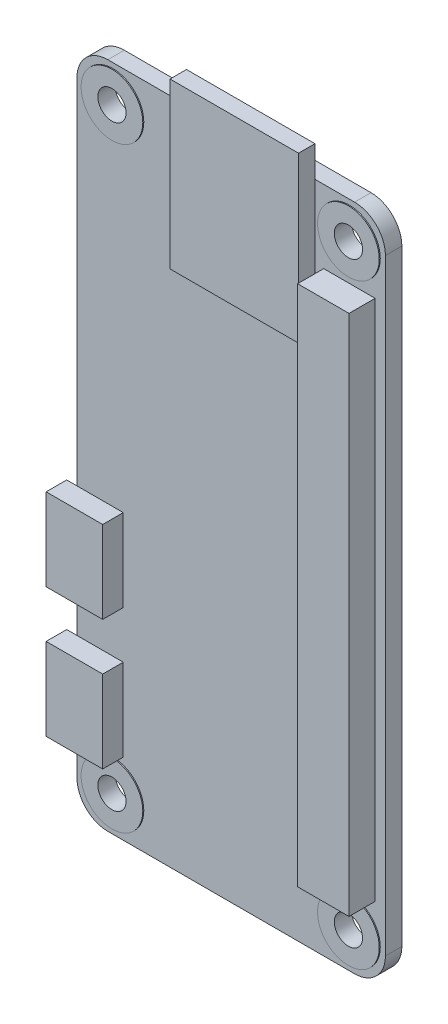
from build123d import *

# Parameters (mm, degrees)
SKETCH1_W           = 30
SKETCH1_H           = 65
SKETCH1_R           = 1.375
BOSS_EXTRUDE1_DEPTH = 0.8
SKETCH4_R           = 3
SKETCH4_R_2         = 1.375
EXTRUDE_THIN1_DEPTH = 0.1
FILLET1_R           = 3
SKETCH2_W           = 12.5
SKETCH2_H           = 16
BOSS_EXTRUDE2_DEPTH = 1.6
SKETCH3_W           = 5
SKETCH3_H           = 50.8
BOSS_EXTRUDE3_DEPTH = 2.54
SKETCH5_W           = 5.5
SKETCH5_H           = 8
BOSS_EXTRUDE4_DEPTH = 2


with BuildPart() as part:
    # Sketch1 → Boss-Extrude1 (new, symmetric)
    with BuildSketch(Plane.XY):
        Rectangle(SKETCH1_W, SKETCH1_H)
        with Locations((11.5, -29)):
            Circle(SKETCH1_R, mode=Mode.SUBTRACT)
        with Locations((-11.5, -29)):
            Circle(SKETCH1_R, mode=Mode.SUBTRACT)
        with Locations((11.5, 29)):
            Circle(SKETCH1_R, mode=Mode.SUBTRACT)
        with Locations((-11.5, 29)):
            Circle(SKETCH1_R, mode=Mode.SUBTRACT)
    extrude(amount=BOSS_EXTRUDE1_DEPTH, both=True)

    # Sketch4 → Extrude-Thin1 (add)
    # profile 1 of 4: a face of its own
    with BuildSketch(Plane.XY.offset(0.8)):
        with Locations((11.5, 29)):
            Circle(SKETCH4_R)
        with Locations((11.5, 29)):
            Circle(SKETCH4_R_2, mode=Mode.SUBTRACT)
    # profile 2 of 4: a face of its own
    with BuildSketch(Plane.XY.offset(0.8)):
        with Locations((11.5, -29)):
            Circle(SKETCH4_R)
        with Locations((11.5, -29)):
            Circle(SKETCH4_R_2, mode=Mode.SUBTRACT)
    # profile 3 of 4: a face of its own
    with BuildSketch(Plane.XY.offset(0.8)):
        with Locations((-11.5, -29)):
            Circle(SKETCH4_R)
        with Locations((-11.5, -29)):
            Circle(SKETCH4_R_2, mode=Mode.SUBTRACT)
    # profile 4 of 4: a face of its own
    with BuildSketch(Plane.XY.offset(0.8)):
        with Locations((-11.5, 29)):
            Circle(SKETCH4_R)
        with Locations((-11.5, 29)):
            Circle(SKETCH4_R_2, mode=Mode.SUBTRACT)
    extrude(amount=EXTRUDE_THIN1_DEPTH)

    # Fillet1
    fillet1_edges = [part.edges().sort_by_distance(p)[0] for p in [
        (-15, -32.5, 0),
        (-15, 32.5, 0),
        (15, 32.5, 0),
        (15, -32.5, 0),
    ]]
    fillet(fillet1_edges, radius=FILLET1_R)

    # Sketch2 → Boss-Extrude2 (add)
    with BuildSketch(Plane.XY.offset(0.8)):
        with Locations((1.9, 27.5)):
            Rectangle(SKETCH2_W, SKETCH2_H)
    extrude(amount=BOSS_EXTRUDE2_DEPTH)

    # Sketch3 → Boss-Extrude3 (add)
    with BuildSketch(Plane.XY.offset(0.8)):
        with Locations((11.5, 0)):
            Rectangle(SKETCH3_W, SKETCH3_H)
    extrude(amount=BOSS_EXTRUDE3_DEPTH)

    # Sketch5 → Boss-Extrude4 (add)
    with BuildSketch(Plane.XY.offset(0.8)):
        with Locations((-13.25, -21.5)):
            Rectangle(SKETCH5_W, SKETCH5_H)
        with Locations((-13.25, -8.9)):
            Rectangle(SKETCH5_W, SKETCH5_H)
    extrude(amount=BOSS_EXTRUDE4_DEPTH)


solid = part.part
